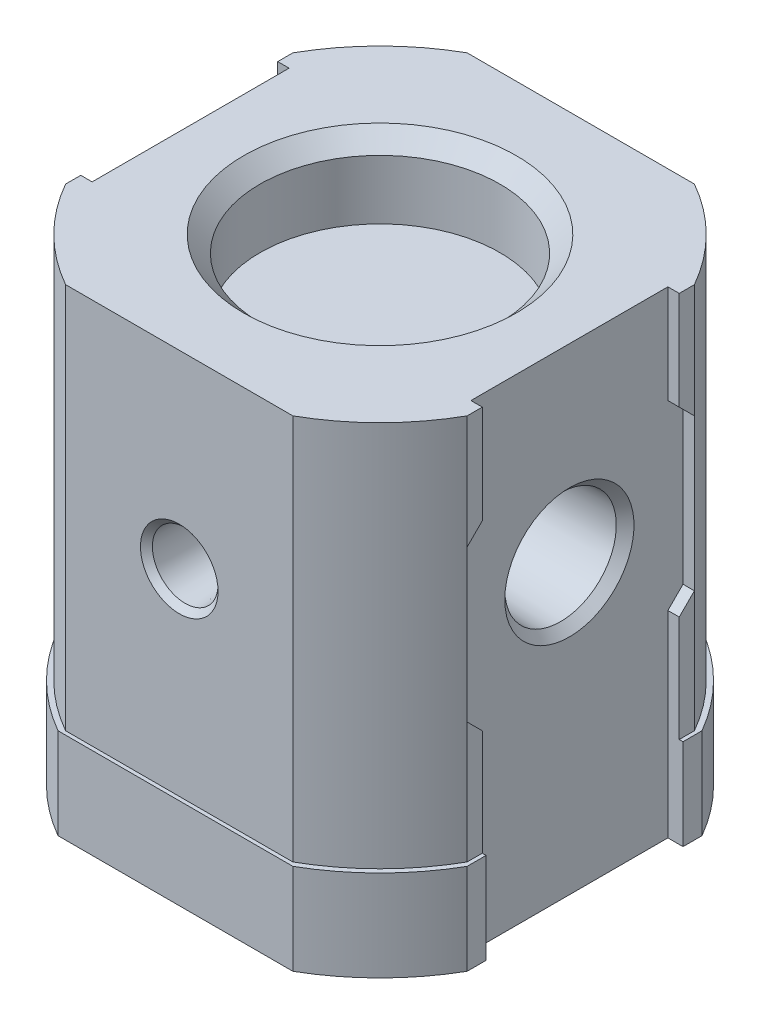
from build123d import *

# Parameters (mm, degrees)
EXTRUDE_1_DEPTH     = 63
EXTRUDE_2_DEPTH     = 12
CUT_EXTRUDE_1_DEPTH = 2
CUT_EXTRUDE_2_DEPTH = 2


with BuildPart() as part:
    # 草图1 → 凸台-拉伸1 (new body)
    with BuildSketch(Plane(origin=(0, 0, 0), x_dir=(1, 0, 0), z_dir=(0, 1, 0))):
        with BuildLine():
            Line((-26.5, 15), (-26.5, -15))
            ThreePointArc((-26.5, -15), (-21.531953, -21.531953), (-15, -26.5))
            Line((-15, -26.5), (15, -26.5))
            ThreePointArc((15, -26.5), (21.531953, -21.531953), (26.5, -15))
            Line((26.5, -15), (26.5, 15))
            ThreePointArc((26.5, 15), (21.531953, 21.531953), (15, 26.5))
            Line((15, 26.5), (-15, 26.5))
            ThreePointArc((-15, 26.5), (-21.531953, 21.531953), (-26.5, 15))
        make_face()
    extrude(amount=EXTRUDE_1_DEPTH)

    # 草图2 → 凸台-拉伸2 (add)
    with BuildSketch(Plane(origin=(0, 0, 0), x_dir=(1, 0, 0), z_dir=(0, 1, 0))):
        with BuildLine():
            Line((-27, 15.5), (-27, -15.5))
            ThreePointArc((-27, -15.5), (-22.014199963, -22.014199963), (-15.5, -27))
            Line((-15.5, -27), (15.5, -27))
            ThreePointArc((15.5, -27), (22.014199963, -22.014199963), (27, -15.5))
            Line((27, -15.5), (27, 15.5))
            ThreePointArc((27, 15.5), (22.014199963, 22.014199963), (15.5, 27))
            Line((15.5, 27), (-15.5, 27))
            ThreePointArc((-15.5, 27), (-22.014199963, 22.014199963), (-27, 15.5))
        make_face()
    extrude(amount=EXTRUDE_2_DEPTH)

    # 草图3 → 切除-拉伸1 (cut)
    with BuildSketch(Plane(origin=(-27, 0, 0), x_dir=(0, 0, -1), z_dir=(1, 0, 0))):
        Polygon((-15, 48), (-15, 28), (-13, 26), (-13, 0), (13, 0), (13, 26), (15, 28), (15, 48), (13, 50), (13, 63), (-13, 63), (-13, 50), align=None)
    extrude(amount=CUT_EXTRUDE_1_DEPTH, mode=Mode.SUBTRACT)

    # 草图4 → 切除-拉伸2 (cut)
    with BuildSketch(Plane(origin=(27, 0, 0), x_dir=(0, 0, -1), z_dir=(1, 0, 0))):
        Polygon((-15, 48), (-15, 28), (-13, 26), (-13, 0), (13, 0), (13, 26), (15, 28), (15, 48), (13, 50), (13, 63), (-13, 63), (-13, 50), align=None)
    extrude(amount=-CUT_EXTRUDE_2_DEPTH, mode=Mode.SUBTRACT)

    # 草图5 → 切除-旋转1 (revolve, cut)
    with BuildSketch(Plane.XY):
        Polygon((0, 63), (18, 63), (15.835, 60.835), (15.835, 53), (0, 53), align=None)
    revolve(axis=Axis((0, 53, 0), (0, 1, 0)), mode=Mode.SUBTRACT)

    # 草图6 → 切除-旋转2 (revolve, cut)
    with BuildSketch(Plane.XY):
        Polygon((0, 8), (24.25, 8), (24.25, 4), (22, 4), (22, 0), (0, 0), align=None)
    revolve(axis=Axis((0, 0, 0), (0, 1, 0)), mode=Mode.SUBTRACT)

    # 草图7 → 切除-旋转3 (revolve, cut)
    with BuildSketch(Plane.XY):
        Polygon((-25, 38), (-25, 46.52745952), (-23.834216348, 45.361675868), (-12.573965271, 45.009775437), (-11.783762402, 45.009775437), (-7.736666667, 38), align=None)
    revolve(axis=Axis((-7.736666667, 38, 0), (-1, 0, 0)), mode=Mode.SUBTRACT)

    # 草图8 → 切除-旋转4 (revolve, cut)
    with BuildSketch(Plane.XY):
        Polygon((7.736666667, 38), (11.783762402, 45.009775437), (12.573965271, 45.009775437), (23.834216348, 45.361675868), (25, 46.52745952), (25, 38), align=None)
    revolve(axis=Axis((25, 38, 0), (-1, 0, 0)), mode=Mode.SUBTRACT)

    # 草图9 → 切除-旋转5 (revolve, cut)
    with BuildSketch(Plane(origin=(0, 0, 0), x_dir=(0, 0, -1), z_dir=(1, 0, 0))):
        Polygon((-26.5, 38), (-26.5, 43.121093906), (-25.712414411, 42.333508317), (-18.399867395, 42.104979803), (-16.804611194, 42.104979803), (-14.4346, 38), align=None)
    revolve(axis=Axis((0, 38, 14.4346), (0, 0, 1)), mode=Mode.SUBTRACT)


solid = part.part
